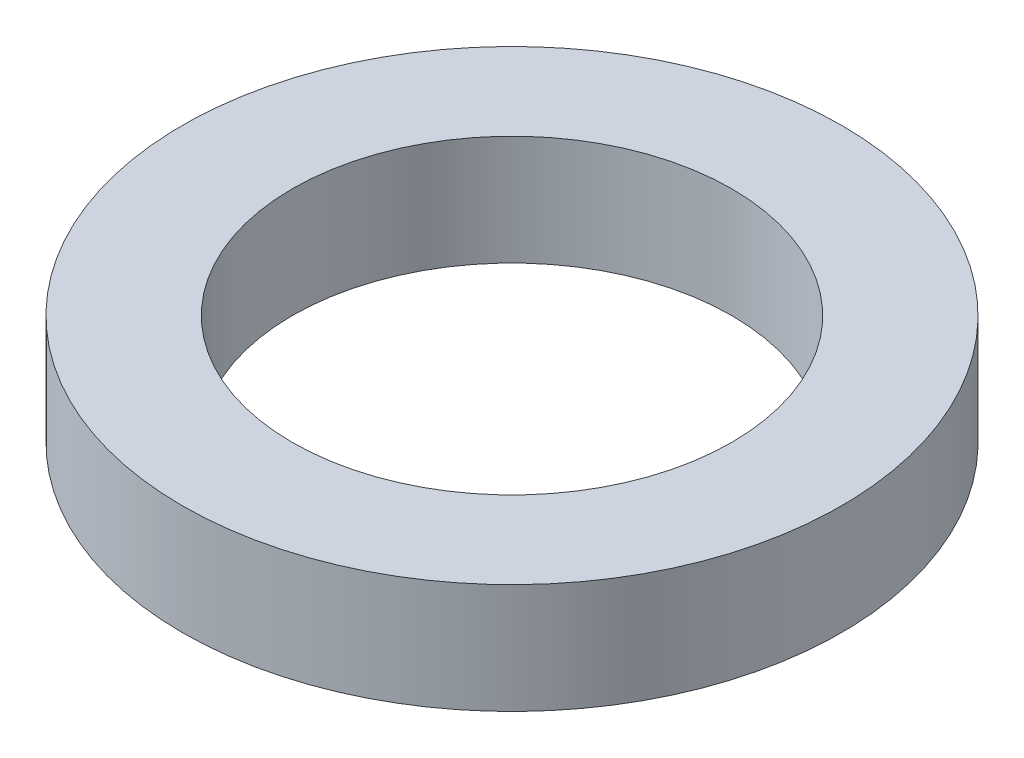
from build123d import *

# Parameters (mm, degrees)
SKETCH_1_R      = 6
SKETCH_1_R_2    = 4
EXTRUDE_1_DEPTH = 2


with BuildPart() as part:
    # Эскиз1 → Бобышка-Вытянуть1 (new body)
    with BuildSketch(Plane(origin=(0, 0, 0), x_dir=(1, 0, 0), z_dir=(0, 1, 0))):
        with Locations(Location((0, 0, 0), (0, 0, 270))):
            Circle(SKETCH_1_R)
        with Locations(Location((0, 0, 0), (0, 0, 270))):
            Circle(SKETCH_1_R_2, mode=Mode.SUBTRACT)
    extrude(amount=EXTRUDE_1_DEPTH)


solid = part.part
